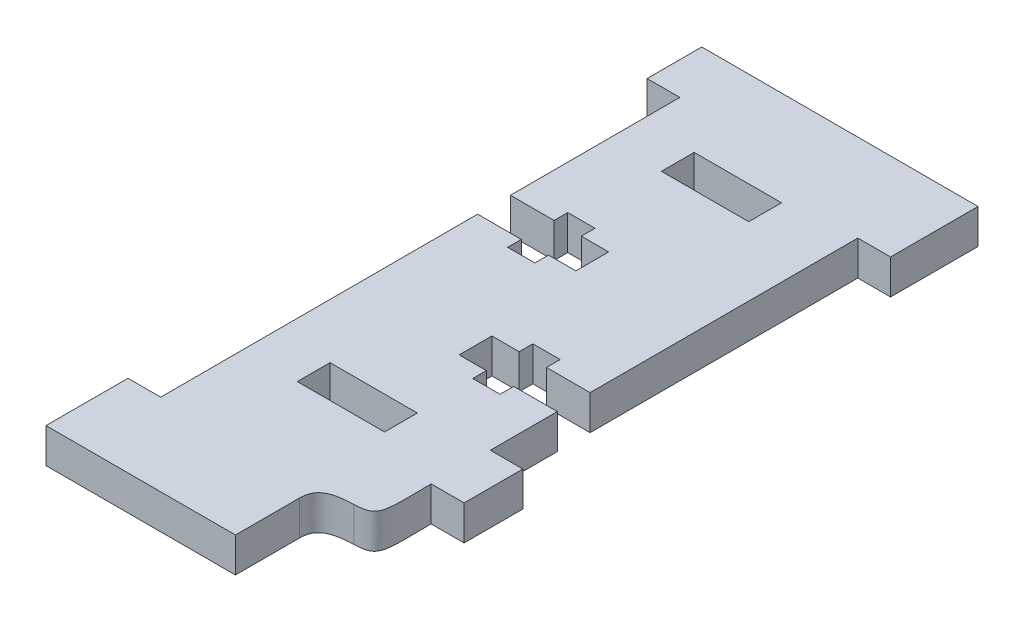
from build123d import *

# Parameters (mm, degrees)
SKETCH1_W           = 7.985890062
SKETCH1_H           = 3.00014889
SKETCH1_W_2         = 7.985890063
SKETCH1_H_2         = 3.000080527
BOSS_EXTRUDE1_DEPTH = 3.175


with BuildPart() as part:
    # Sketch1 → Boss-Extrude1 (new body)
    with BuildSketch(Plane(origin=(0, 0, 0), x_dir=(1, 0, 0), z_dir=(0, 1, 0))):
        with BuildLine():
            Line((8.450778283, -13.38162857), (8.406948402, -13.382009456))
            Line((8.406948402, -13.382009456), (5.43267765, -13.382009456))
            Line((5.43267765, -13.382009456), (5.476497782, -13.38162857))
            Line((5.476497782, -13.38162857), (5.476497782, -7.251478059))
            Line((5.476497782, -7.251478059), (1.483591746, -7.251478059))
            Line((1.483591746, -7.251478059), (1.483591746, -8.50154498))
            Line((1.483591746, -8.50154498), (-1.012030582, -8.50154498))
            Line((-1.012030582, -8.50154498), (-1.012030582, -7.251478059))
            Line((-1.012030582, -7.251478059), (-3.507584669, -7.251478059))
            Line((-3.507584669, -7.251478059), (-3.507584669, -4.251397533))
            Line((-3.507584669, -4.251397533), (-1.012030582, -4.251397533))
            Line((-1.012030582, -4.251397533), (-1.012030582, -3.001320846))
            Line((-1.012030582, -3.001320846), (1.483591746, -3.001320846))
            Line((1.483591746, -3.001320846), (1.483591746, -4.251397533))
            Line((1.483591746, -4.251397533), (5.476497782, -4.251397533))
            Line((5.476497782, -4.251397533), (5.476497782, 20.246361134))
            Line((5.476497782, 20.246361134), (8.471221179, 20.246361134))
            Line((8.471221179, 20.246361134), (8.471221179, 28.246728876))
            Line((8.471221179, 28.246728876), (-16.804601477, 28.246728876))
            Line((-16.804601477, 28.246728876), (-16.804601477, 23.246510025))
            Line((-16.804601477, 23.246510025), (-13.809887829, 23.246510025))
            Line((-13.809887829, 23.246510025), (-13.809887829, 7.746043514))
            Line((-13.809887829, 7.746043514), (-9.816981793, 7.746043514))
            Line((-9.816981793, 7.746043514), (-9.816981793, 8.996110434))
            Line((-9.816981793, 8.996110434), (-7.321417957, 8.996110434))
            Line((-7.321417957, 8.996110434), (-7.321417957, 7.746043514))
            Line((-7.321417957, 7.746043514), (-4.825805378, 7.746043514))
            Line((-4.825805378, 7.746043514), (-4.825805378, 4.745894623))
            Line((-4.825805378, 4.745894623), (-7.321417957, 4.745894623))
            Line((-7.321417957, 4.745894623), (-7.321417957, 3.495827702))
            Line((-7.321417957, 3.495827702), (-9.816981793, 3.495827702))
            Line((-9.816981793, 3.495827702), (-9.816981793, 4.745894623))
            Line((-9.816981793, 4.745894623), (-13.809887829, 4.745894623))
            Line((-13.809887829, 4.745894623), (-13.809887829, -24.255271193))
            Line((-13.809887829, -24.255271193), (-16.804601477, -24.255271193))
            Line((-16.804601477, -24.255271193), (-16.804601477, -31.755565288))
            Line((-16.804601477, -31.755565288), (0.529541194, -31.755565288))
            Line((0.529541194, -31.755565288), (0.529541194, -25.875998513))
            add(Edge.make_bspline(
                [(0.529541194, -25.875998513), (0.529541194, -24.216108328), (1.884173069, -23.980760021), (3.543615638, -23.915862955)],
                knots=[38, 38, 38, 38, 39, 39, 39, 39], degree=3))
            add(Edge.make_bspline(
                [(3.543615638, -23.915862955), (5.651300627, -23.833288885), (5.482317719, -23.277547326), (5.43267765, -18.755056825)],
                knots=[39, 39, 39, 39, 40, 40, 40, 40], degree=3))
            add(Edge.make_bspline(
                [(5.43267765, -18.755056825), (6.324629372, -18.755056826), (7.369010812, -18.755056826), (8.450778283, -18.755056826)],
                knots=[40, 40, 40, 40, 41, 41, 41, 41], degree=3))
            Line((8.450778283, -18.755056826), (8.450778283, -13.38162857))
        make_face()
        with Locations((-4.805196753, 18.048513823)):
            Rectangle(SKETCH1_W, SKETCH1_H, mode=Mode.SUBTRACT)
        with Locations((-4.805196754, -15.272154822)):
            Rectangle(SKETCH1_W_2, SKETCH1_H_2, mode=Mode.SUBTRACT)
    extrude(amount=BOSS_EXTRUDE1_DEPTH)


solid = part.part
